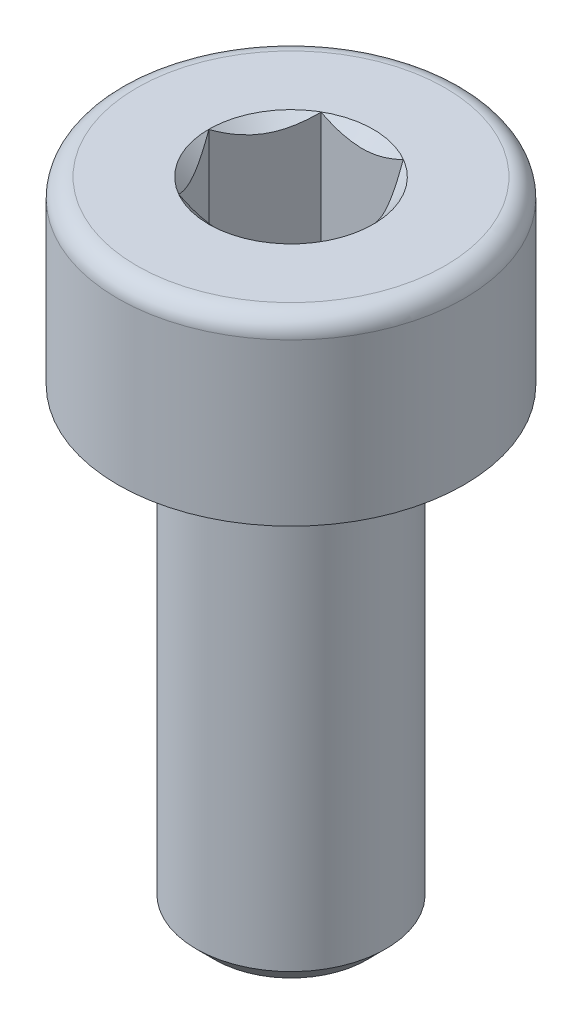
from build123d import *

# Parameters (mm, degrees)
CUT_EXTRUDE1_DEPTH  = 1.1
BOSS_EXTRUDE1_REACH = 9.727
BOSS_EXTRUDE1_START = -0.5
SKETCH2_3_R         = 1.309481769


with BuildPart() as part:
    # Sketch1 → Revolve1 (revolve)
    with BuildSketch(Plane(origin=(0, 0, 0), x_dir=(0, 0, -1), z_dir=(1, 0, 0))):
        with BuildLine():
            Line((0, -4.85), (0.8, -4.85))
            Line((0.8, -4.85), (1, -4.65))
            Line((1, -4.65), (1, -0.2))
            ThreePointArc((1, -0.2), (1.058578644, -0.058578644), (1.2, 0))
            Line((1.2, 0), (1.825, 0))
            Line((1.825, 0), (1.825, 1.7))
            ThreePointArc((1.825, 1.7), (1.766421356, 1.841421356), (1.625, 1.9))
            Line((1.625, 1.9), (0.8675, 1.9))
            Line((0.8675, 1.9), (0.75, 1.7825))
            Line((0.75, 1.7825), (0.75, 0.9))
            Line((0.75, 0.9), (0.8675, 0.9))
            Line((0.8675, 0.9), (0.8675, 0.7))
            Line((0.8675, 0.7), (0, 0.199148641))
            Line((0, 0.199148641), (0, -4.85))
        make_face()
    revolve(axis=Axis((0, 2.837665271, 0), (0, -1, 0)))

    # Sketch2 → Cut-Extrude1 (cut)
    with BuildSketch(Plane(origin=(0, 1.9, 0), x_dir=(1, 0, 0), z_dir=(0, 1, 0))):
        Polygon((-0.433012702, -0.75), (0.433012702, -0.75), (0.866025404, 0), (0.433012702, 0.75), (-0.433012702, 0.75), (-0.866025404, 0), align=None)
    extrude(amount=-CUT_EXTRUDE1_DEPTH, mode=Mode.SUBTRACT)

    # Boss-Extrude1: up to this cone (the profile starts inside it)
    boss_extrude1_end = Plane(origin=(0, 1.4, 0), z_dir=(0, 1, 0)).offset(-1.200850359) * Cone(1.732e-06, 23.39617325, 13.507785924, align=(Align.CENTER, Align.CENTER, Align.MIN), mode=Mode.PRIVATE)
    # Sketch2<3> → Boss-Extrude1 (add, up to the surface)
    with BuildSketch(Plane(origin=(0, 1.9, 0), x_dir=(1, 0, 0), z_dir=(0, 1, 0)).offset(BOSS_EXTRUDE1_START), mode=Mode.PRIVATE) as boss_extrude1_sk1:
        Circle(SKETCH2_3_R)
        Polygon((0.433012702, -0.75), (0.866025404, 0), (0.433012702, 0.75), (-0.433012702, 0.75), (-0.866025404, 0), (-0.433012702, -0.75), align=None, mode=Mode.SUBTRACT)
    boss_extrude1_tool1 = extrude(boss_extrude1_sk1.sketch, amount=-BOSS_EXTRUDE1_REACH, mode=Mode.PRIVATE) & boss_extrude1_end
    add(boss_extrude1_tool1.solids().sort_by_distance((-1.272444, 1.4, 0))[0])


solid = part.part
